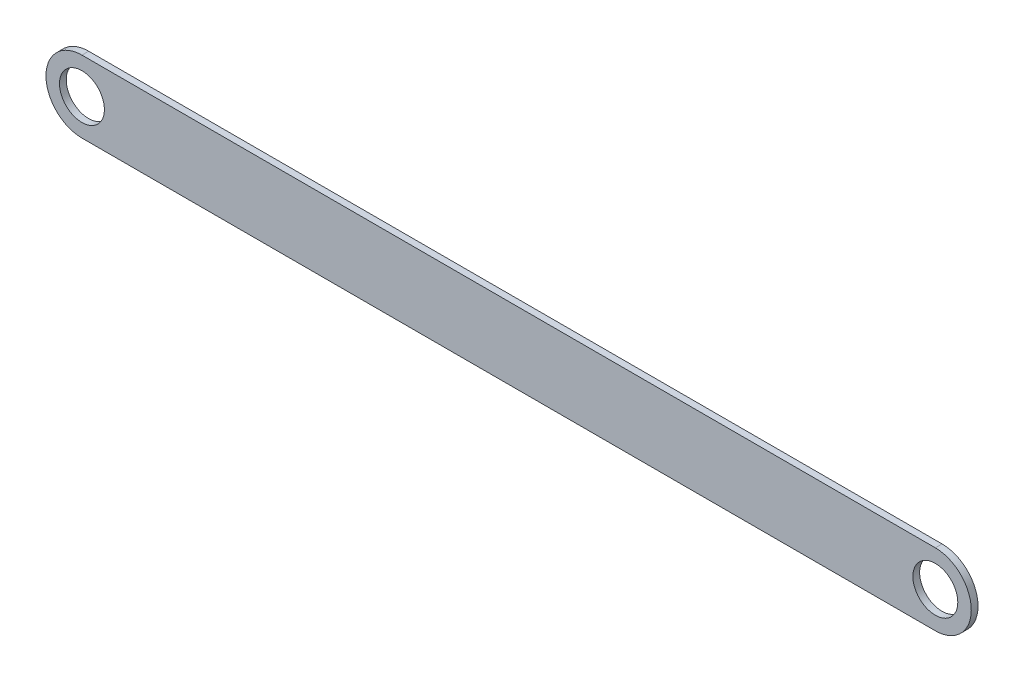
from build123d import *

# Parameters (mm, degrees)
SKETCH1_R           = 5
BOSS_EXTRUDE1_DEPTH = 1.5


with BuildPart() as part:
    # Sketch1 → Boss-Extrude1 (new body)
    with BuildSketch(Plane.XY):
        with BuildLine():
            Line((-95, 8), (95, 8))
            ThreePointArc((95, 8), (103, 0), (95, -8))
            Line((95, -8), (-95, -8))
            ThreePointArc((-95, -8), (-103, 0), (-95, 8))
        make_face()
        with Locations((-95, 0)):
            Circle(SKETCH1_R, mode=Mode.SUBTRACT)
        with Locations((95, 0)):
            Circle(SKETCH1_R, mode=Mode.SUBTRACT)
    extrude(amount=BOSS_EXTRUDE1_DEPTH)


solid = part.part
